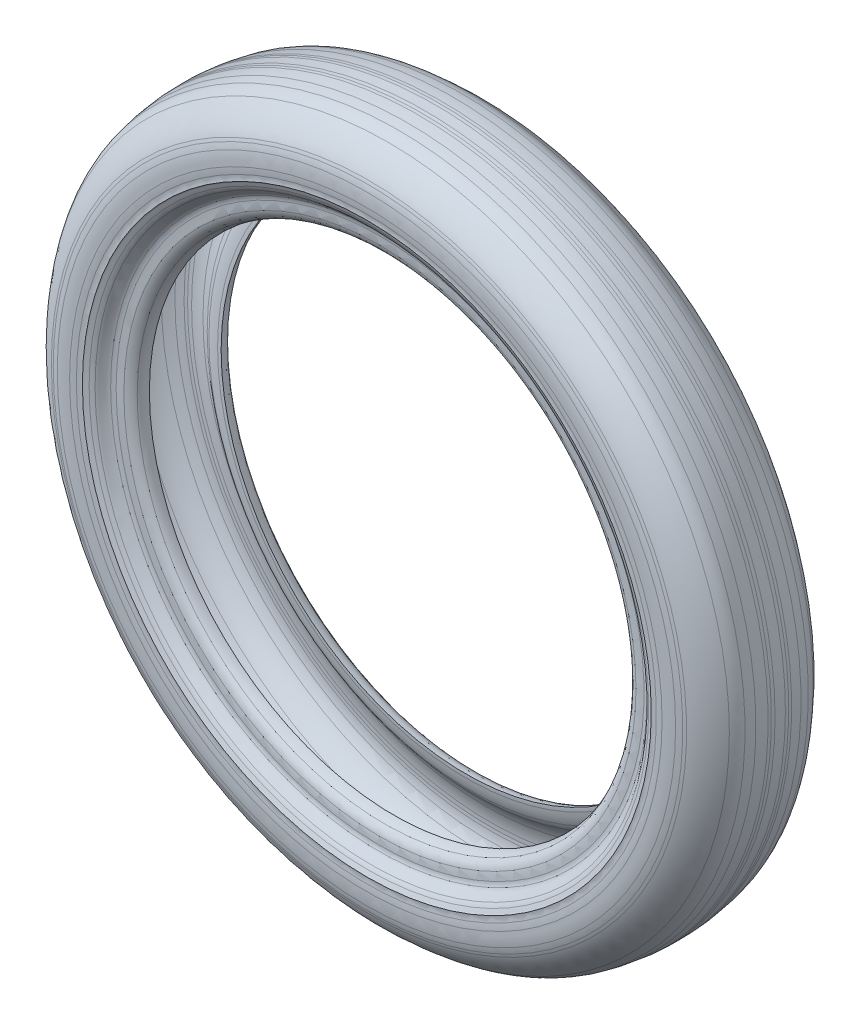
from build123d import *


with BuildPart() as part:
    # Sketch1 → Revolve1 (revolve)
    with BuildSketch(Plane(origin=(0, 0, 0), x_dir=(0, 0, -1), z_dir=(1, 0, 0)), mode=Mode.PRIVATE) as revolve1_sk:
        with BuildLine():
            Line((-4.087225423, 277), (4.087225423, 277))
            add(Edge.make_bspline(
                [(6.838271043, 276.870395592), (5.886714931, 276.925722787), (5.035419147, 276.99296955), (4.087225423, 277)],
                knots=[0, 0, 0, 0, 1, 1, 1, 1], degree=3))
            add(Edge.make_bspline(
                [(9.283644724, 276.711446085), (8.447326855, 276.77044073), (7.688343936, 276.821029403), (6.838271043, 276.870395592)],
                knots=[0, 0, 0, 0, 1, 1, 1, 1], degree=3))
            add(Edge.make_bspline(
                [(17.842453116, 275.585504044), (15.010863197, 276.026741602), (12.129295746, 276.510925631), (9.283644724, 276.711446085)],
                knots=[0, 0, 0, 0, 1, 1, 1, 1], degree=3))
            add(Edge.make_bspline(
                [(25.025738494, 274.164742224), (22.655406816, 274.773028571), (20.268110969, 275.207541146), (17.842453116, 275.585504044)],
                knots=[0, 0, 0, 0, 1, 1, 1, 1], degree=3))
            add(Edge.make_bspline(
                [(33.126039078, 269.872193634), (30.655447479, 271.748406747), (28.041648672, 273.39078139), (25.025738494, 274.164742224)],
                knots=[0, 0, 0, 0, 1, 1, 1, 1], degree=3))
            add(Edge.make_bspline(
                [(48.368848839, 251.325866344), (45.409763035, 258.609565295), (39.342485368, 265.151246311), (33.126039078, 269.872193634)],
                knots=[0, 0, 0, 0, 1, 1, 1, 1], degree=3))
            add(Edge.make_bspline(
                [(49.152469104, 249.033328327), (48.905409923, 249.814931567), (48.677913327, 250.565050006), (48.368848839, 251.325866344)],
                knots=[0, 0, 0, 0, 1, 1, 1, 1], degree=3))
            add(Edge.make_bspline(
                [(50.380719068, 244.601088569), (50.101717191, 246.106215788), (49.61398737, 247.57313465), (49.152469104, 249.033328327)],
                knots=[0, 0, 0, 0, 1, 1, 1, 1], degree=3))
            add(Edge.make_bspline(
                [(50.851866197, 234.361085632), (50.888714314, 237.782623834), (50.998619198, 241.267738089), (50.380719068, 244.601088569)],
                knots=[0, 0, 0, 0, 1, 1, 1, 1], degree=3))
            add(Edge.make_bspline(
                [(50.412111963, 229.470336029), (50.653470365, 231.262186596), (50.832593594, 232.570615683), (50.851866197, 234.361085632)],
                knots=[0, 0, 0, 0, 1, 1, 1, 1], degree=3))
            add(Edge.make_bspline(
                [(50.090820401, 225.038099532), (49.824121812, 226.548878621), (50.182704917, 227.767287177), (50.412111963, 229.470336029)],
                knots=[0, 0, 0, 0, 1, 1, 1, 1], degree=3))
            add(Edge.make_bspline(
                [(48.422463865, 221.370038705), (49.097891212, 222.746936427), (49.252668502, 223.871956766), (50.090820401, 225.038099532)],
                knots=[0, 0, 0, 0, 1, 1, 1, 1], degree=3))
            add(Edge.make_bspline(
                [(46.708042802, 218.361460572), (47.47061716, 219.280463053), (47.907315085, 220.319898975), (48.422463865, 221.370038705)],
                knots=[0, 0, 0, 0, 1, 1, 1, 1], degree=3))
            add(Edge.make_bspline(
                [(40.553862252, 212.199580559), (41.891328931, 215.069379037), (44.844117896, 216.115388532), (46.708042802, 218.361460572)],
                knots=[0, 0, 0, 0, 1, 1, 1, 1], degree=3))
            add(Edge.make_bspline(
                [(39.573878872, 208.83749388), (39.653200279, 210.045660599), (40.034984685, 211.086321246), (40.553862252, 212.199580559)],
                knots=[0, 0, 0, 0, 1, 1, 1, 1], degree=3))
            add(Edge.make_bspline(
                [(39.688199897, 202.571221263), (40.068761412, 204.468376965), (39.445649171, 206.886391599), (39.573878872, 208.83749388)],
                knots=[0, 0, 0, 0, 1, 1, 1, 1], degree=3))
            add(Edge.make_bspline(
                [(35.701934997, 196.051396183), (37.692010628, 197.560193908), (39.193622825, 200.10490968), (39.688199897, 202.571221263)],
                knots=[0, 0, 0, 0, 1, 1, 1, 1], degree=3))
            add(Edge.make_bspline(
                [(28.384706913, 193.735033754), (30.815485074, 193.974504673), (33.727906583, 194.554742538), (35.701934997, 196.051396183)],
                knots=[0.040130533, 0.040130533, 0.040130533, 0.040130533, 1, 1, 1, 1], degree=3))
            add(Edge.make_bspline(
                [(28.384706913, 193.735033754), (28.411032698, 194.874828258), (28.568996654, 195.819233164), (28.771592777, 196.916296193)],
                knots=[-0.038042047, -0.038042047, -0.038042047, -0.038042047, 1, 1, 1, 1], degree=3))
            add(Edge.make_bspline(
                [(28.771592777, 196.916296193), (29.392564908, 200.28021405), (30.323946686, 203.776638567), (31.8567374, 206.850629432)],
                knots=[0, 0, 0, 0, 1, 1, 1, 1], degree=3))
            add(Edge.make_bspline(
                [(31.8567374, 206.850629432), (32.809974707, 208.762757751), (34.241129569, 210.348890833), (35.606565416, 211.964518587)],
                knots=[0, 0, 0, 0, 1, 1, 1, 1], degree=3))
            add(Edge.make_bspline(
                [(35.606565416, 211.964518587), (38.573873585, 215.475158878), (41.487994872, 219.05212484), (43.500843454, 223.204069119)],
                knots=[0, 0, 0, 0, 1, 1, 1, 1], degree=3))
            add(Edge.make_bspline(
                [(43.500843454, 223.204069119), (45.434828322, 227.193238511), (46.973854739, 231.634491917), (47.307098473, 236.042282012)],
                knots=[0, 0, 0, 0, 1, 1, 1, 1], degree=3))
            add(Edge.make_bspline(
                [(47.307098473, 236.042282012), (47.395070594, 237.20597003), (47.467025925, 238.241893987), (47.495132441, 239.404669269)],
                knots=[0, 0, 0, 0, 1, 1, 1, 1], degree=3))
            add(Edge.make_bspline(
                [(47.495132441, 239.404669269), (47.517094548, 240.313279725), (47.432775407, 241.111235995), (47.348623774, 242.002880855)],
                knots=[0, 0, 0, 0, 1, 1, 1, 1], degree=3))
            add(Edge.make_bspline(
                [(47.348623774, 242.002880855), (47.165541892, 243.942977323), (46.770506617, 246.290536252), (46.201299995, 248.115396513)],
                knots=[0, 0, 0, 0, 1, 1, 1, 1], degree=3))
            add(Edge.make_bspline(
                [(46.201299995, 248.115396513), (45.503910338, 250.351079587), (43.69494521, 253.134832082), (42.403481516, 255.146763446)],
                knots=[0, 0, 0, 0, 1, 1, 1, 1], degree=3))
            add(Edge.make_bspline(
                [(42.403481516, 255.146763446), (39.196221035, 260.143426471), (34.460907547, 264.329906765), (28.99947126, 266.695652959)],
                knots=[0, 0, 0, 0, 1, 1, 1, 1], degree=3))
            add(Edge.make_bspline(
                [(28.99947126, 266.695652959), (26.583288822, 267.742120145), (24.08381104, 268.135214405), (21.663349606, 269.103582463)],
                knots=[0, 0, 0, 0, 1, 1, 1, 1], degree=3))
            add(Edge.make_bspline(
                [(21.663349606, 269.103582463), (19.632008088, 269.916210364), (17.694660831, 270.266204705), (15.549915099, 270.594342906)],
                knots=[0, 0, 0, 0, 1, 1, 1, 1], degree=3))
            add(Edge.make_bspline(
                [(15.549915099, 270.594342906), (14.603860874, 270.738925841), (13.738198519, 270.833531243), (12.798869479, 270.905364508)],
                knots=[0, 0, 0, 0, 1, 1, 1, 1], degree=3))
            add(Edge.make_bspline(
                [(12.798869479, 270.905364508), (11.963774297, 270.969096861), (11.193940235, 271.073024844), (10.353495595, 271.206756636)],
                knots=[0, 0, 0, 0, 1, 1, 1, 1], degree=3))
            add(Edge.make_bspline(
                [(10.353495595, 271.206756636), (8.978890207, 271.425617394), (7.775918685, 271.486904577), (6.37976344, 271.503410851)],
                knots=[0, 0, 0, 0, 1, 1, 1, 1], degree=3))
            add(Edge.make_bspline(
                [(6.37976344, 271.503410851), (4.759244938, 271.522513704), (3.310972051, 271.652578454), (1.641851131, 271.653037166)],
                knots=[0, 0, 0, 0, 1, 1, 1, 1], degree=3))
            add(Edge.make_bspline(
                [(1.641851131, 271.653037166), (1.102911324, 271.653196372), (0.552888554, 271.657111121), (0, 271.660193828)],
                knots=[0, 0, 0, 0, 0.347073441, 0.347073441, 0.347073441, 0.347073441], degree=3))
            add(Edge.make_bspline(
                [(-1.641851131, 271.653037166), (-1.102911324, 271.653196372), (-0.552888554, 271.657111121), (0, 271.660193828)],
                knots=[0, 0, 0, 0, 0.347073441, 0.347073441, 0.347073441, 0.347073441], degree=3))
            add(Edge.make_bspline(
                [(-6.37976344, 271.503410851), (-4.759244938, 271.522513704), (-3.310972051, 271.652578454), (-1.641851131, 271.653037166)],
                knots=[0, 0, 0, 0, 1, 1, 1, 1], degree=3))
            add(Edge.make_bspline(
                [(-10.353495595, 271.206756636), (-8.978890207, 271.425617394), (-7.775918685, 271.486904577), (-6.37976344, 271.503410851)],
                knots=[0, 0, 0, 0, 1, 1, 1, 1], degree=3))
            add(Edge.make_bspline(
                [(-12.798869479, 270.905364508), (-11.963774297, 270.969096861), (-11.193940235, 271.073024844), (-10.353495595, 271.206756636)],
                knots=[0, 0, 0, 0, 1, 1, 1, 1], degree=3))
            add(Edge.make_bspline(
                [(-15.549915099, 270.594342906), (-14.603860874, 270.738925841), (-13.738198519, 270.833531243), (-12.798869479, 270.905364508)],
                knots=[0, 0, 0, 0, 1, 1, 1, 1], degree=3))
            add(Edge.make_bspline(
                [(-21.663349606, 269.103582463), (-19.632008088, 269.916210364), (-17.694660831, 270.266204705), (-15.549915099, 270.594342906)],
                knots=[0, 0, 0, 0, 1, 1, 1, 1], degree=3))
            add(Edge.make_bspline(
                [(-28.99947126, 266.695652959), (-26.583288822, 267.742120145), (-24.08381104, 268.135214405), (-21.663349606, 269.103582463)],
                knots=[0, 0, 0, 0, 1, 1, 1, 1], degree=3))
            add(Edge.make_bspline(
                [(-42.403481516, 255.146763446), (-39.196221035, 260.143426471), (-34.460907547, 264.329906765), (-28.99947126, 266.695652959)],
                knots=[0, 0, 0, 0, 1, 1, 1, 1], degree=3))
            add(Edge.make_bspline(
                [(-46.201299995, 248.115396513), (-45.503910338, 250.351079587), (-43.69494521, 253.134832082), (-42.403481516, 255.146763446)],
                knots=[0, 0, 0, 0, 1, 1, 1, 1], degree=3))
            add(Edge.make_bspline(
                [(-47.348623774, 242.002880855), (-47.165541892, 243.942977323), (-46.770506617, 246.290536252), (-46.201299995, 248.115396513)],
                knots=[0, 0, 0, 0, 1, 1, 1, 1], degree=3))
            add(Edge.make_bspline(
                [(-47.495132441, 239.404669269), (-47.517094548, 240.313279725), (-47.432775407, 241.111235995), (-47.348623774, 242.002880855)],
                knots=[0, 0, 0, 0, 1, 1, 1, 1], degree=3))
            add(Edge.make_bspline(
                [(-47.307098473, 236.042282012), (-47.395070594, 237.20597003), (-47.467025925, 238.241893987), (-47.495132441, 239.404669269)],
                knots=[0, 0, 0, 0, 1, 1, 1, 1], degree=3))
            add(Edge.make_bspline(
                [(-43.500843454, 223.204069119), (-45.434828322, 227.193238511), (-46.973854739, 231.634491917), (-47.307098473, 236.042282012)],
                knots=[0, 0, 0, 0, 1, 1, 1, 1], degree=3))
            add(Edge.make_bspline(
                [(-35.606565416, 211.964518587), (-38.573873585, 215.475158878), (-41.487994872, 219.05212484), (-43.500843454, 223.204069119)],
                knots=[0, 0, 0, 0, 1, 1, 1, 1], degree=3))
            add(Edge.make_bspline(
                [(-31.8567374, 206.850629432), (-32.809974707, 208.762757751), (-34.241129569, 210.348890833), (-35.606565416, 211.964518587)],
                knots=[0, 0, 0, 0, 1, 1, 1, 1], degree=3))
            add(Edge.make_bspline(
                [(-28.771592777, 196.916296193), (-29.392564908, 200.28021405), (-30.323946686, 203.776638567), (-31.8567374, 206.850629432)],
                knots=[0, 0, 0, 0, 1, 1, 1, 1], degree=3))
            add(Edge.make_bspline(
                [(-28.384706913, 193.735033754), (-28.411032698, 194.874828258), (-28.568996654, 195.819233164), (-28.771592777, 196.916296193)],
                knots=[-0.038042047, -0.038042047, -0.038042047, -0.038042047, 1, 1, 1, 1], degree=3))
            add(Edge.make_bspline(
                [(-28.384706913, 193.735033754), (-30.815485074, 193.974504673), (-33.727906583, 194.554742538), (-35.701934997, 196.051396183)],
                knots=[0.040130533, 0.040130533, 0.040130533, 0.040130533, 1, 1, 1, 1], degree=3))
            add(Edge.make_bspline(
                [(-35.701934997, 196.051396183), (-37.692010628, 197.560193908), (-39.193622825, 200.10490968), (-39.688199897, 202.571221263)],
                knots=[0, 0, 0, 0, 1, 1, 1, 1], degree=3))
            add(Edge.make_bspline(
                [(-39.688199897, 202.571221263), (-40.068761412, 204.468376965), (-39.445649171, 206.886391599), (-39.573878872, 208.83749388)],
                knots=[0, 0, 0, 0, 1, 1, 1, 1], degree=3))
            add(Edge.make_bspline(
                [(-39.573878872, 208.83749388), (-39.653200279, 210.045660599), (-40.034984685, 211.086321246), (-40.553862252, 212.199580559)],
                knots=[0, 0, 0, 0, 1, 1, 1, 1], degree=3))
            add(Edge.make_bspline(
                [(-40.553862252, 212.199580559), (-41.891328931, 215.069379037), (-44.844117896, 216.115388532), (-46.708042802, 218.361460572)],
                knots=[0, 0, 0, 0, 1, 1, 1, 1], degree=3))
            add(Edge.make_bspline(
                [(-46.708042802, 218.361460572), (-47.47061716, 219.280463053), (-47.907315085, 220.319898975), (-48.422463865, 221.370038705)],
                knots=[0, 0, 0, 0, 1, 1, 1, 1], degree=3))
            add(Edge.make_bspline(
                [(-48.422463865, 221.370038705), (-49.097891212, 222.746936427), (-49.252668502, 223.871956766), (-50.090820401, 225.038099532)],
                knots=[0, 0, 0, 0, 1, 1, 1, 1], degree=3))
            add(Edge.make_bspline(
                [(-50.090820401, 225.038099532), (-49.824121812, 226.548878621), (-50.182704917, 227.767287177), (-50.412111963, 229.470336029)],
                knots=[0, 0, 0, 0, 1, 1, 1, 1], degree=3))
            add(Edge.make_bspline(
                [(-50.412111963, 229.470336029), (-50.653470365, 231.262186596), (-50.832593594, 232.570615683), (-50.851866197, 234.361085632)],
                knots=[0, 0, 0, 0, 1, 1, 1, 1], degree=3))
            add(Edge.make_bspline(
                [(-50.851866197, 234.361085632), (-50.888714314, 237.782623834), (-50.998619198, 241.267738089), (-50.380719068, 244.601088569)],
                knots=[0, 0, 0, 0, 1, 1, 1, 1], degree=3))
            add(Edge.make_bspline(
                [(-50.380719068, 244.601088569), (-50.101717191, 246.106215788), (-49.61398737, 247.57313465), (-49.152469104, 249.033328327)],
                knots=[0, 0, 0, 0, 1, 1, 1, 1], degree=3))
            add(Edge.make_bspline(
                [(-49.152469104, 249.033328327), (-48.905409923, 249.814931567), (-48.677913327, 250.565050006), (-48.368848839, 251.325866344)],
                knots=[0, 0, 0, 0, 1, 1, 1, 1], degree=3))
            add(Edge.make_bspline(
                [(-48.368848839, 251.325866344), (-45.409763035, 258.609565295), (-39.342485368, 265.151246311), (-33.126039078, 269.872193634)],
                knots=[0, 0, 0, 0, 1, 1, 1, 1], degree=3))
            add(Edge.make_bspline(
                [(-33.126039078, 269.872193634), (-30.655447479, 271.748406747), (-28.041648672, 273.39078139), (-25.025738494, 274.164742224)],
                knots=[0, 0, 0, 0, 1, 1, 1, 1], degree=3))
            add(Edge.make_bspline(
                [(-25.025738494, 274.164742224), (-22.655406816, 274.773028571), (-20.268110969, 275.207541146), (-17.842453116, 275.585504044)],
                knots=[0, 0, 0, 0, 1, 1, 1, 1], degree=3))
            add(Edge.make_bspline(
                [(-17.842453116, 275.585504044), (-15.010863197, 276.026741602), (-12.129295746, 276.510925631), (-9.283644724, 276.711446085)],
                knots=[0, 0, 0, 0, 1, 1, 1, 1], degree=3))
            add(Edge.make_bspline(
                [(-9.283644724, 276.711446085), (-8.447326855, 276.77044073), (-7.688343936, 276.821029403), (-6.838271043, 276.870395592)],
                knots=[0, 0, 0, 0, 1, 1, 1, 1], degree=3))
            add(Edge.make_bspline(
                [(-6.838271043, 276.870395592), (-5.886714931, 276.925722787), (-5.035419147, 276.99296955), (-4.087225423, 277)],
                knots=[0, 0, 0, 0, 1, 1, 1, 1], degree=3))
        make_face()
    revolve(revolve1_sk.sketch.rotate(Axis((0, 0, -80.9), (0, 0, 1)), 90), axis=Axis((0, 0, -80.9), (0, 0, 1)))


solid = part.part
